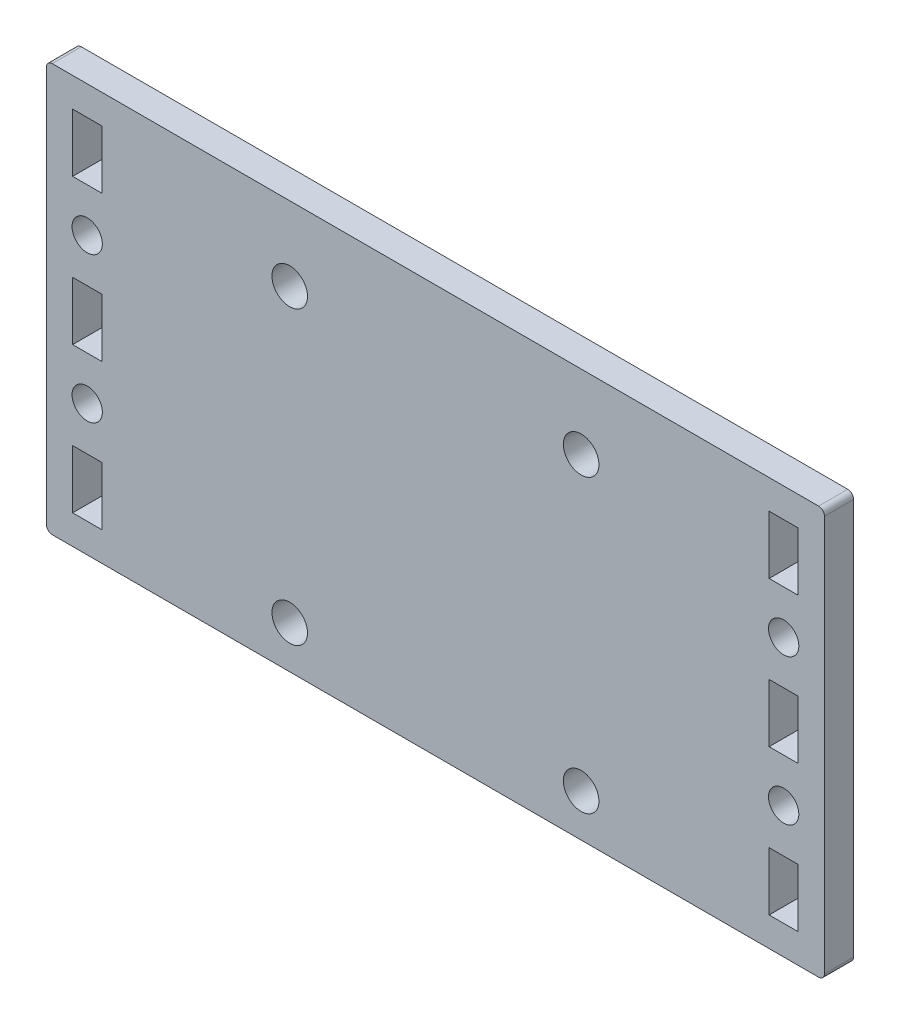
from build123d import *

# Parameters (mm, degrees)
SKETCH1_W           = 133.5
SKETCH1_H           = 70
SKETCH1_R           = 3.05
SKETCH1_R_2         = 2.6
SKETCH1_W_2         = 5
SKETCH1_H_2         = 10
BOSS_EXTRUDE1_DEPTH = 5
FILLET1_R           = 1


with BuildPart() as part:
    # Sketch1 → Boss-Extrude1 (new body)
    with BuildSketch(Plane.XY):
        Rectangle(SKETCH1_W, SKETCH1_H)
        with Locations((25, 22.3)):
            Circle(SKETCH1_R, mode=Mode.SUBTRACT)
        with Locations(Location((-25, 22.3, 0), (0, 0, 180))):
            Circle(SKETCH1_R, mode=Mode.SUBTRACT)
        with Locations((-59.75, -12.5)):
            Circle(SKETCH1_R_2, mode=Mode.SUBTRACT)
        with Locations(Location((59.75, -12.5, 0), (0, 0, 180))):
            Circle(SKETCH1_R_2, mode=Mode.SUBTRACT)
        with Locations(Location((-59.75, 12.5, 0), (0, 0, 180))):
            Circle(SKETCH1_R_2, mode=Mode.SUBTRACT)
        with Locations((59.75, 12.5)):
            Circle(SKETCH1_R_2, mode=Mode.SUBTRACT)
        with Locations((25, -27.7)):
            Circle(SKETCH1_R, mode=Mode.SUBTRACT)
        with Locations(Location((-25, -27.7, 0), (0, 0, 180))):
            Circle(SKETCH1_R, mode=Mode.SUBTRACT)
        with Locations((-59.75, -25)):
            Rectangle(SKETCH1_W_2, SKETCH1_H_2, mode=Mode.SUBTRACT)
        with Locations((59.75, -25)):
            Rectangle(SKETCH1_W_2, SKETCH1_H_2, mode=Mode.SUBTRACT)
        with Locations((-59.75, 0)):
            Rectangle(SKETCH1_W_2, SKETCH1_H_2, mode=Mode.SUBTRACT)
        with Locations((59.75, 0)):
            Rectangle(SKETCH1_W_2, SKETCH1_H_2, mode=Mode.SUBTRACT)
        with Locations((-59.75, 25)):
            Rectangle(SKETCH1_W_2, SKETCH1_H_2, mode=Mode.SUBTRACT)
        with Locations((59.75, 25)):
            Rectangle(SKETCH1_W_2, SKETCH1_H_2, mode=Mode.SUBTRACT)
    extrude(amount=BOSS_EXTRUDE1_DEPTH)

    # Fillet1
    fillet1_edges = [part.edges().sort_by_distance(p)[0] for p in [
        (66.75, -35, 2.5),
        (-66.75, -35, 2.5),
        (-66.75, 35, 2.5),
        (66.75, 35, 2.5),
    ]]
    fillet(fillet1_edges, radius=FILLET1_R)


solid = part.part
